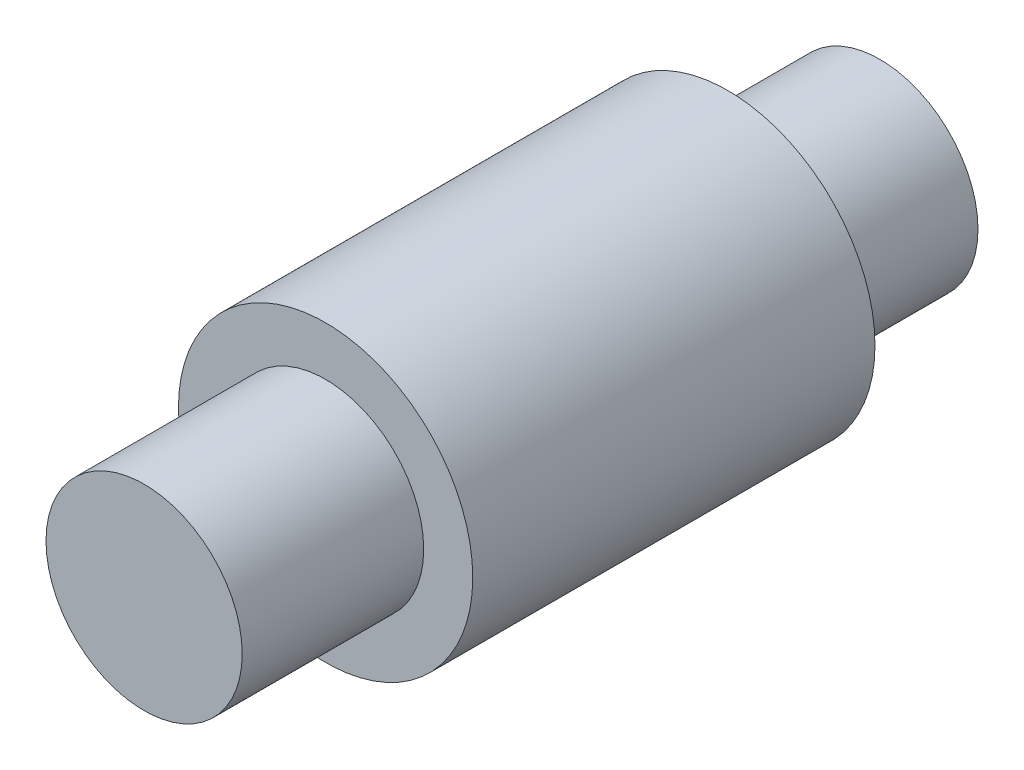
from build123d import *

# Parameters (mm, degrees)
SKETCH1_R           = 15
BOSS_EXTRUDE1_DEPTH = 41
SKETCH2_R           = 10
BOSS_EXTRUDE2_DEPTH = 8.5
BOSS_EXTRUDE3_START = 5.5
SKETCH3_R           = 10
BOSS_EXTRUDE3_DEPTH = 5.5
SKETCH4_R           = 10
BOSS_EXTRUDE4_DEPTH = 10
BOSS_EXTRUDE5_START = 10
SKETCH5_R           = 10
BOSS_EXTRUDE5_DEPTH = 10


with BuildPart() as part:
    # Sketch1 → Boss-Extrude1 (new body)
    with BuildSketch(Plane.XY):
        Circle(SKETCH1_R)
    extrude(amount=BOSS_EXTRUDE1_DEPTH)

    # Sketch2 → Boss-Extrude2 (add)
    with BuildSketch(Plane.XY.offset(41)):
        Circle(SKETCH2_R)
    extrude(amount=BOSS_EXTRUDE2_DEPTH)

    # Sketch3 → Boss-Extrude3 (add)
    with BuildSketch(Plane(origin=(0, 0, 0), x_dir=(-1, 0, 0), z_dir=(0, 0, -1)).offset(BOSS_EXTRUDE3_START)):
        with Locations(Location((0, 0, 0), (0, 0, 180))):
            Circle(SKETCH3_R)
    extrude(amount=-BOSS_EXTRUDE3_DEPTH)

    # Sketch4 → Boss-Extrude4 (add)
    with BuildSketch(Plane.XY.offset(49.5)):
        Circle(SKETCH4_R)
    extrude(amount=BOSS_EXTRUDE4_DEPTH)

    # Sketch5 → Boss-Extrude5 (add)
    with BuildSketch(Plane(origin=(0, 0, -5.5), x_dir=(-1, 0, 0), z_dir=(0, 0, -1)).offset(BOSS_EXTRUDE5_START)):
        with Locations(Location((0, 0, 0), (0, 0, 180))):
            Circle(SKETCH5_R)
    extrude(amount=-BOSS_EXTRUDE5_DEPTH)


solid = part.part
